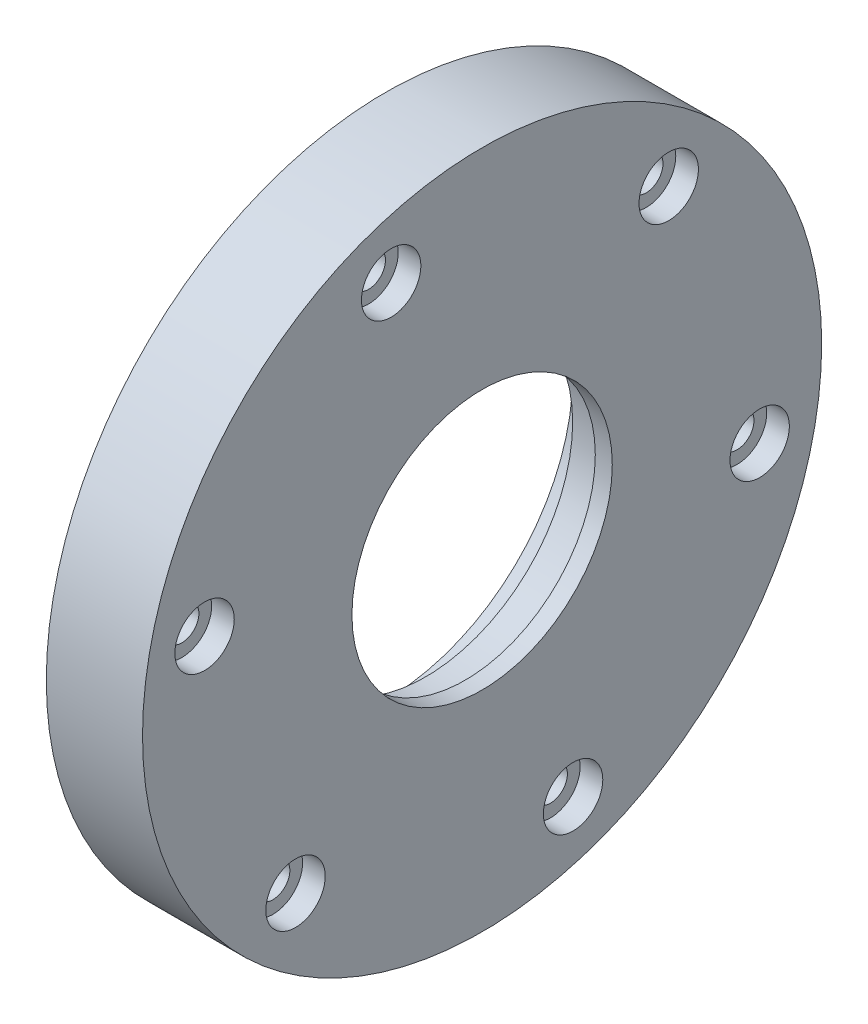
from build123d import *

# Parameters (mm, degrees)
SKETCH2_R          = 2.5
CUT_EXTRUDE1_DEPTH = 4
SKETCH3_R          = 3
CUT_EXTRUDE4_DEPTH = 87.539008545
SKETCH4_R          = 5.25
CUT_EXTRUDE5_DEPTH = 4


with BuildPart() as part:
    # Sketch1 → Revolve1 (revolve)
    with BuildSketch(Plane.XY, mode=Mode.PRIVATE) as revolve1_sk:
        Polygon((0, 60), (0, 33), (7, 33), (7, 26), (14, 26), (14, 23), (17, 23), (17, 60), align=None)
    revolve(revolve1_sk.sketch.rotate(Axis((0, 0, 0), (1, 0, 0)), 90), axis=Axis((0, 0, 0), (1, 0, 0)))

    # Sketch2 → Cut-Extrude1 (cut)
    with BuildSketch(Plane.ZY):
        with Locations((0, 40)):
            Circle(SKETCH2_R)
        with Locations((15.307337295, 36.9551813)):
            Circle(SKETCH2_R)
        with Locations((28.284271247, 28.284271247)):
            Circle(SKETCH2_R)
        with Locations((36.9551813, 15.307337295)):
            Circle(SKETCH2_R)
        with Locations((40, 0)):
            Circle(SKETCH2_R)
        with Locations((36.9551813, -15.307337295)):
            Circle(SKETCH2_R)
        with Locations((28.284271247, -28.284271247)):
            Circle(SKETCH2_R)
        with Locations((15.307337295, -36.9551813)):
            Circle(SKETCH2_R)
        with Locations((0, -40)):
            Circle(SKETCH2_R)
        with Locations((-15.307337295, -36.9551813)):
            Circle(SKETCH2_R)
        with Locations((-28.284271247, -28.284271247)):
            Circle(SKETCH2_R)
        with Locations((-36.9551813, -15.307337295)):
            Circle(SKETCH2_R)
        with Locations((-40, 0)):
            Circle(SKETCH2_R)
        with Locations((-36.9551813, 15.307337295)):
            Circle(SKETCH2_R)
        with Locations((-28.284271247, 28.284271247)):
            Circle(SKETCH2_R)
        with Locations((-15.307337295, 36.9551813)):
            Circle(SKETCH2_R)
    extrude(amount=-CUT_EXTRUDE1_DEPTH, mode=Mode.SUBTRACT)

    # Sketch3 → Cut-Extrude4 (cut, through all)
    with BuildSketch(Plane(origin=(17, 0, 0), x_dir=(0, 0, -1), z_dir=(1, 0, 0))):
        with Locations((49.03926402, -9.754516101)):
            Circle(SKETCH3_R)
        with Locations((16.071973265, -47.346506475)):
            Circle(SKETCH3_R)
        with Locations((-32.967290755, -37.591990374)):
            Circle(SKETCH3_R)
        with Locations((-49.03926402, 9.754516101)):
            Circle(SKETCH3_R)
        with Locations((-16.071973265, 47.346506475)):
            Circle(SKETCH3_R)
        with Locations((32.967290755, 37.591990374)):
            Circle(SKETCH3_R)
    extrude(amount=-CUT_EXTRUDE4_DEPTH, mode=Mode.SUBTRACT)

    # Sketch4 → Cut-Extrude5 (cut)
    with BuildSketch(Plane(origin=(17, 0, 0), x_dir=(0, 0, -1), z_dir=(1, 0, 0))):
        with Locations((32.967290755, 37.591990374)):
            Circle(SKETCH4_R)
        with Locations((49.03926402, -9.754516101)):
            Circle(SKETCH4_R)
        with Locations((16.071973265, -47.346506475)):
            Circle(SKETCH4_R)
        with Locations((-32.967290755, -37.591990374)):
            Circle(SKETCH4_R)
        with Locations((-49.03926402, 9.754516101)):
            Circle(SKETCH4_R)
        with Locations((-16.071973265, 47.346506475)):
            Circle(SKETCH4_R)
    extrude(amount=-CUT_EXTRUDE5_DEPTH, mode=Mode.SUBTRACT)


solid = part.part
